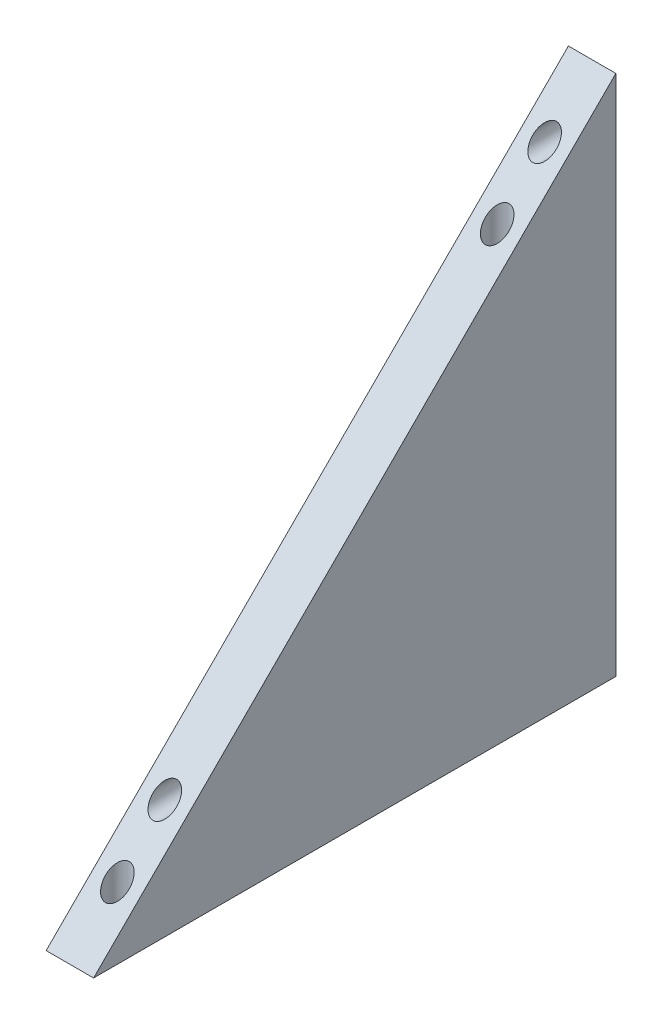
from build123d import *

# Parameters (mm, degrees)
BOSS_EXTRUDE1_DEPTH = 8
SKETCH2_R           = 2
CUT_EXTRUDE1_DEPTH  = 125.707658145
SKETCH3_R           = 2
CUT_EXTRUDE2_DEPTH  = 125.707658145


with BuildPart() as part:
    # Sketch1 → Boss-Extrude1 (new body)
    with BuildSketch(Plane(origin=(0, 0, 0), x_dir=(0, 0, -1), z_dir=(1, 0, 0))):
        Polygon((-88, 0), (0, 0), (0, 88), align=None)
    extrude(amount=BOSS_EXTRUDE1_DEPTH)

    # Sketch2 → Cut-Extrude1 (cut, through all)
    with BuildSketch(Plane(origin=(0, 0, 0), x_dir=(1, 0, 0), z_dir=(0, 1, 0))):
        with Locations(Location((4, -16, 0), (0, 0, 270))):
            Circle(SKETCH2_R)
        with Locations(Location((4, -80, 0), (0, 0, 270))):
            Circle(SKETCH2_R)
    extrude(amount=CUT_EXTRUDE1_DEPTH, mode=Mode.SUBTRACT)

    # Sketch3 → Cut-Extrude2 (cut, through all)
    with BuildSketch(Plane.XY):
        with Locations((4, 16)):
            Circle(SKETCH3_R)
        with Locations(Location((4, 80, 0), (0, 0, 90))):
            Circle(SKETCH3_R)
    extrude(amount=CUT_EXTRUDE2_DEPTH, mode=Mode.SUBTRACT)


solid = part.part
